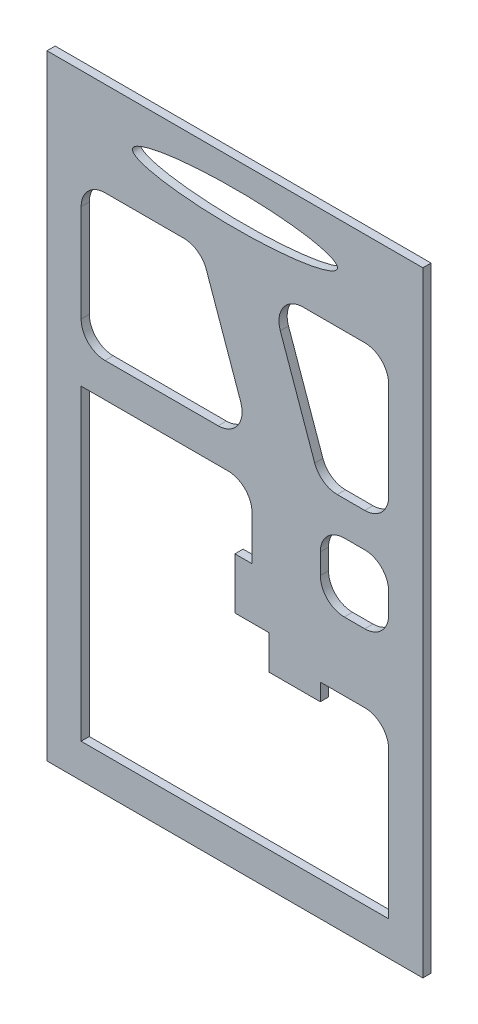
from build123d import *

# Parameters (mm, degrees)
BOSS_EXTRUDE1_DEPTH     = 0.12
CUT_EXTRUDE1_DEPTH      = 22.096388316
CUT_EXTRUDE1_DEPTH_BACK = 22.096388316
SKETCH3_RX              = 3
SKETCH3_RY              = 0.5
SKETCH3_W               = 2
SKETCH3_H               = 2
FILLET1_R               = 0.7


with BuildPart() as part:
    # Sketch1 → Boss-Extrude1 (new, symmetric)
    with BuildSketch(Plane.XY):
        Polygon((0, 0), (-11, 0), (-11, 11), (-11, 18), (0, 18), (0, 11), align=None)
        Polygon((-1, 1), (-1, 6), (-3, 6), (-3, 5.5), (-4.5, 5.5), (-4.5, 6.5), (-5.5, 6.5), (-5.5, 8), (-5, 8), (-5, 10), (-10, 10), (-10, 1), align=None, mode=Mode.SUBTRACT)
    extrude(amount=BOSS_EXTRUDE1_DEPTH, both=True)

    # Sketch3 → Cut-Extrude1 (cut, two sides: drawn at the far end of the back side and taken through both)
    with BuildSketch(Plane.XY.offset(0.12).offset(-CUT_EXTRUDE1_DEPTH_BACK)):
        with Locations(Location((-5.5, 16.75), (0, 0, 180))):
            Ellipse(SKETCH3_RX, SKETCH3_RY)
        Polygon((-10, 11), (-5, 11), (-6.5, 15.25), (-10, 15.25), align=None)
        Polygon((-1, 11), (-1, 15.25), (-4.5, 15.25), (-3, 11), align=None)
        with Locations((-2, 9)):
            Rectangle(SKETCH3_W, SKETCH3_H)
    extrude(amount=CUT_EXTRUDE1_DEPTH + CUT_EXTRUDE1_DEPTH_BACK, mode=Mode.SUBTRACT)

    # Fillet1
    fillet1_edges = [part.edges().sort_by_distance(p)[0] for p in [
        (-1, 6, 0),
        (-5, 10, 0),
        (-1, 10, 0),
        (-1, 8, 0),
        (-3, 8, 0),
        (-3, 10, 0),
        (-4.5, 15.25, 0),
        (-1, 15.25, 0),
        (-1, 11, 0),
        (-3, 11, 0),
        (-10, 11, 0),
        (-10, 15.25, 0),
        (-6.5, 15.25, 0),
        (-5, 11, 0),
    ]]
    fillet(fillet1_edges, radius=FILLET1_R)


solid = part.part
